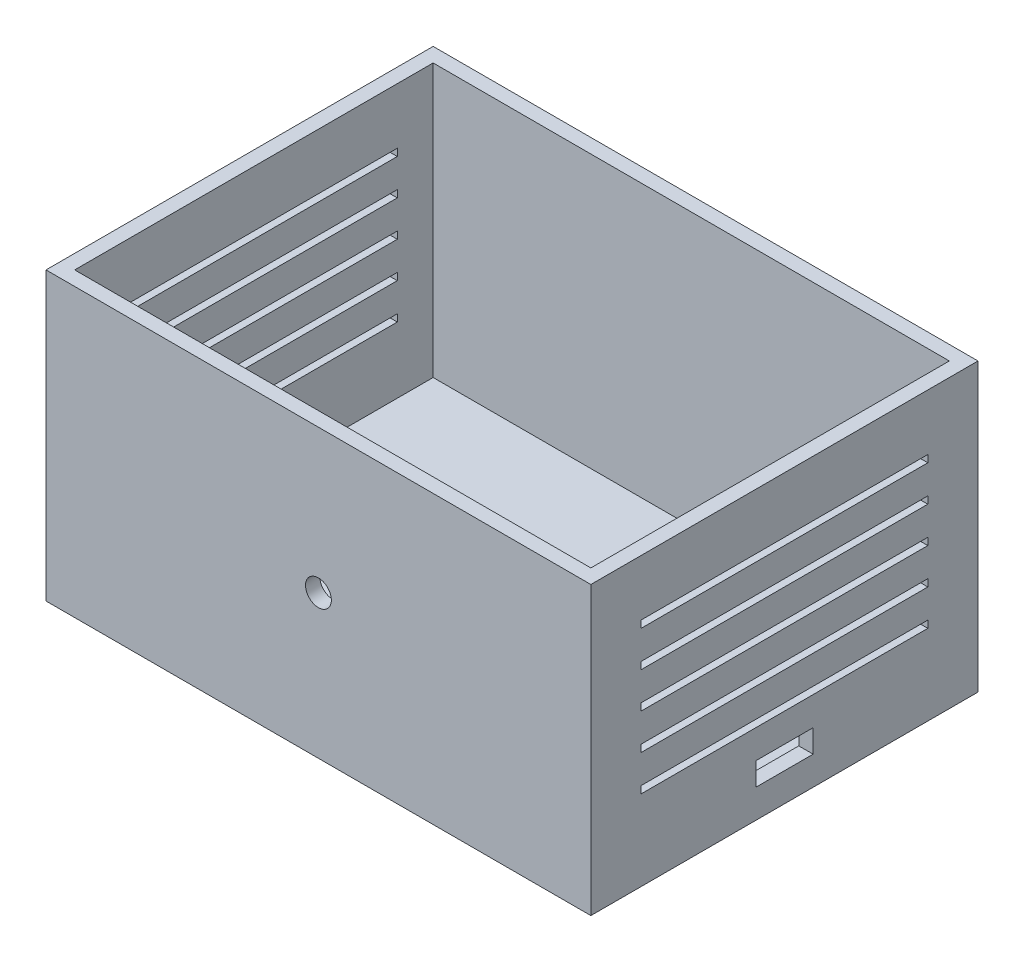
from build123d import *

# Parameters (mm, degrees)
SKETCH1_W           = 180
SKETCH1_H           = 125
BOSS_EXTRUDE1_DEPTH = 100
SKETCH2_W           = 180
SKETCH2_H           = 125
BOSS_EXTRUDE2_DEPTH = 5
SKETCH3_W           = 100
SKETCH3_H           = 2.5
CUT_EXTRUDE1_DEPTH  = 200
SKETCH4_W           = 20
SKETCH4_H           = 8
BOSS_EXTRUDE4_DEPTH = 5
SKETCH5_R           = 4.5
CUT_EXTRUDE2_DEPTH  = 5


with BuildPart() as part:
    # Sketch1 → Boss-Extrude1 (new body)
    with BuildSketch(Plane(origin=(0, 0, 0), x_dir=(1, 0, 0), z_dir=(0, 1, 0))):
        Polygon((185, 5), (0, 5), (-5, 5), (-5, -130), (185, -130), align=None)
        with Locations((90, -62.5)):
            Rectangle(SKETCH1_W, SKETCH1_H, mode=Mode.SUBTRACT)
    extrude(amount=BOSS_EXTRUDE1_DEPTH)

    # Sketch2 → Boss-Extrude2 (add)
    with BuildSketch(Plane(origin=(0, 0, 0), x_dir=(-1, 0, 0), z_dir=(0, -1, 0))):
        with Locations((-90, -62.5)):
            Rectangle(SKETCH2_W, SKETCH2_H)
    extrude(amount=-BOSS_EXTRUDE2_DEPTH)

    # Sketch3 → Cut-Extrude1 (cut)
    with BuildSketch(Plane(origin=(185, 0, 0), x_dir=(0, 0, -1), z_dir=(1, 0, 0))):
        Polygon((-62.5, 10), (-52.5, 10), (-52.5, 18), (-72.5, 18), (-72.5, 10), align=None)
        Polygon((-62.5, 28), (-12.5, 28), (-12.5, 30.5), (-112.5, 30.5), (-112.5, 28), align=None)
        with Locations((-62.5, 41.75)):
            Rectangle(SKETCH3_W, SKETCH3_H)
        with Locations((-62.5, 54.25)):
            Rectangle(SKETCH3_W, SKETCH3_H)
        with Locations((-62.5, 66.75)):
            Rectangle(SKETCH3_W, SKETCH3_H)
        with Locations((-62.5, 79.25)):
            Rectangle(SKETCH3_W, SKETCH3_H)
    extrude(amount=-CUT_EXTRUDE1_DEPTH, mode=Mode.SUBTRACT)

    # Sketch4 → Boss-Extrude4 (add)
    with BuildSketch(Plane.ZY.offset(5)):
        with Locations((62.5, 14)):
            Rectangle(SKETCH4_W, SKETCH4_H)
    extrude(amount=-BOSS_EXTRUDE4_DEPTH)

    # Sketch5 → Cut-Extrude2 (cut)
    with BuildSketch(Plane.XY.offset(130)):
        with Locations((90, 50)):
            Circle(SKETCH5_R)
    extrude(amount=-CUT_EXTRUDE2_DEPTH, mode=Mode.SUBTRACT)


solid = part.part
